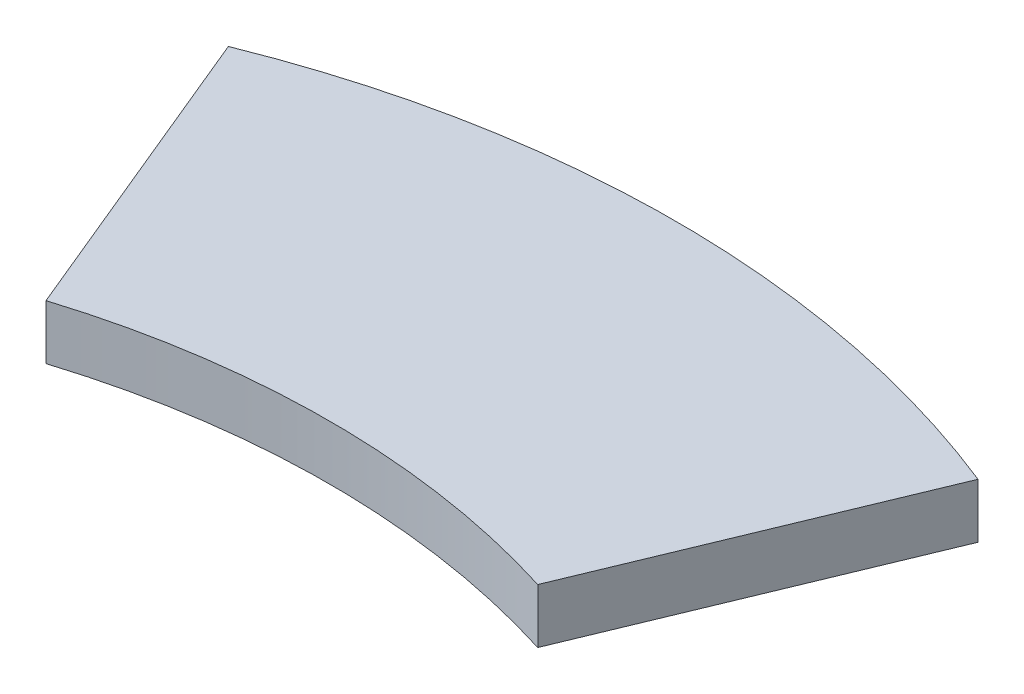
from build123d import *

# Parameters (mm, degrees)
BOSS_EXTRUDE1_DEPTH = 5


with BuildPart() as part:
    # Sketch2 → Boss-Extrude1 (new, symmetric)
    with BuildSketch(Plane(origin=(0, 0, 0), x_dir=(1, 0, 0), z_dir=(0, 1, 0))):
        with BuildLine():
            Line((-44.61537926, -34.378162107), (-68.246198751, 22.6716828))
            ThreePointArc((-68.246198751, 22.6716828), (0.444031685, 35.940056953), (69.134262122, 22.6716828))
            Line((69.134262122, 22.6716828), (45.50344263, -34.378162107))
            ThreePointArc((45.50344263, -34.378162107), (0.444031685, -27.498422603), (-44.61537926, -34.378162107))
        make_face()
    extrude(amount=BOSS_EXTRUDE1_DEPTH, both=True)


solid = part.part
